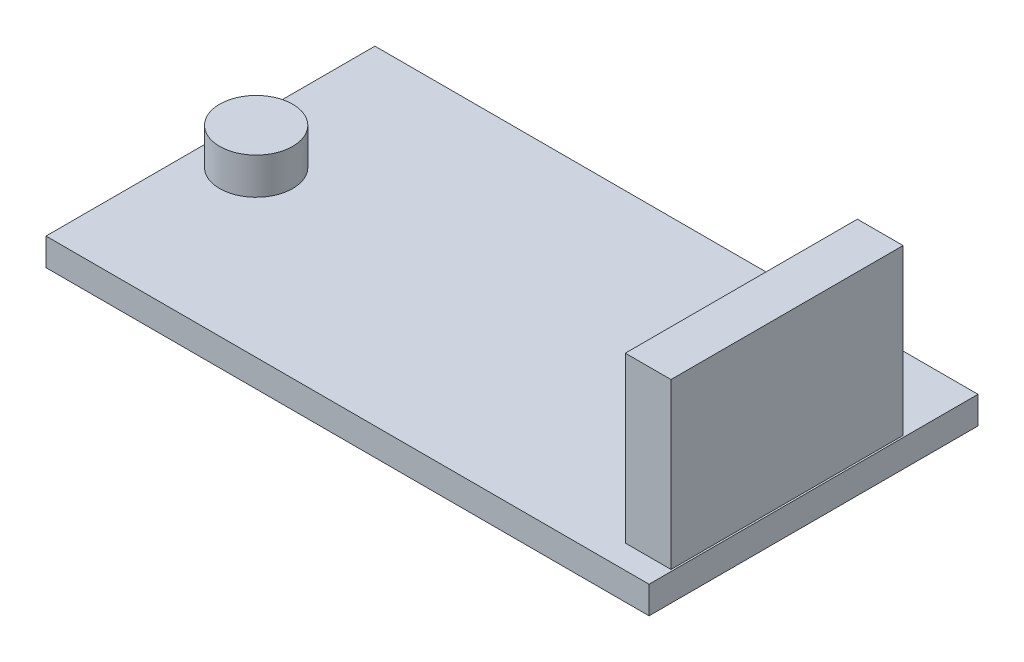
from build123d import *

# Parameters (mm, degrees)
SKETCH1_W           = 33
SKETCH1_H           = 18
BOSS_EXTRUDE1_DEPTH = 1.5
SKETCH2_W           = 2.5
SKETCH2_H           = 12.7
BOSS_EXTRUDE2_DEPTH = 9
SKETCH3_R           = 2
BOSS_EXTRUDE3_DEPTH = 2


with BuildPart() as part:
    # Sketch1 → Boss-Extrude1 (new body)
    with BuildSketch(Plane(origin=(0, 0, 0), x_dir=(1, 0, 0), z_dir=(0, 1, 0))):
        Rectangle(SKETCH1_W, SKETCH1_H)
    extrude(amount=BOSS_EXTRUDE1_DEPTH)

    # Sketch2 → Boss-Extrude2 (add)
    with BuildSketch(Plane(origin=(0, 1.5, 0), x_dir=(1, 0, 0), z_dir=(0, 1, 0))):
        with Locations((15.15, -1.35)):
            Rectangle(SKETCH2_W, SKETCH2_H)
    extrude(amount=BOSS_EXTRUDE2_DEPTH)

    # Sketch3 → Boss-Extrude3 (add)
    with BuildSketch(Plane(origin=(0, 1.5, 0), x_dir=(1, 0, 0), z_dir=(0, 1, 0))):
        with Locations(Location((-14, 0, 0), (0, 0, 270))):
            Circle(SKETCH3_R)
    extrude(amount=BOSS_EXTRUDE3_DEPTH)


solid = part.part
